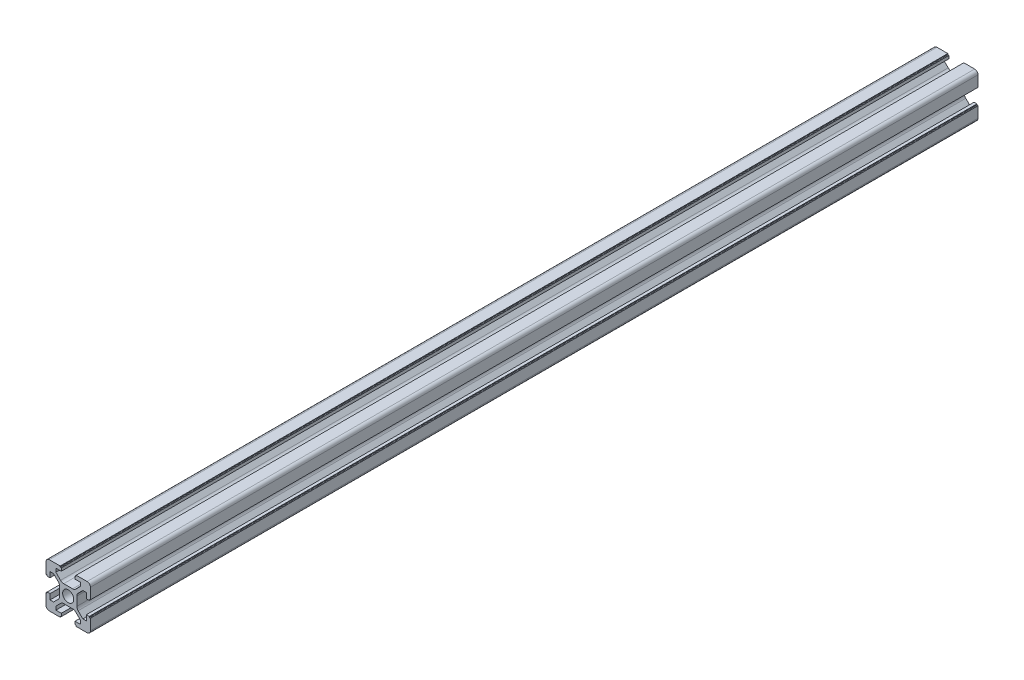
from build123d import *

# Parameters (mm, degrees)
SKETCH1_R      = 2.5
EXTRUDE1_DEPTH = 400


with BuildPart() as part:
    # Sketch1 → Extrude1 (new body)
    with BuildSketch(Plane.XY):
        with BuildLine():
            Line((0, 3.9), (-2.010912703, 3.9))
            ThreePointArc((-2.010912703, 3.9), (-2.776279568, 4.052240935), (-3.425126266, 4.485786438))
            Line((-3.425126266, 4.485786438), (-5.539339828, 6.6))
            Line((-5.539339828, 6.6), (-5.539339828, 8.2))
            Line((-5.539339828, 8.2), (-3.1, 8.2))
            Line((-3.1, 8.2), (-3.1, 9.5))
            Line((-3.1, 9.5), (-3.4, 9.5))
            ThreePointArc((-3.4, 9.5), (-3.541421356, 9.558578644), (-3.6, 9.7))
            Line((-3.6, 9.7), (-3.6, 10))
            Line((-3.6, 10), (-8.5, 10))
            ThreePointArc((-8.5, 10), (-9.560660172, 9.560660172), (-10, 8.5))
            Line((-10, 8.5), (-10, 3.6))
            Line((-10, 3.6), (-9.7, 3.6))
            ThreePointArc((-9.7, 3.6), (-9.558578644, 3.541421356), (-9.5, 3.4))
            Line((-9.5, 3.4), (-9.5, 3.1))
            Line((-9.5, 3.1), (-8.2, 3.1))
            Line((-8.2, 3.1), (-8.2, 5.539339828))
            Line((-8.2, 5.539339828), (-6.6, 5.539339828))
            Line((-6.6, 5.539339828), (-4.485786438, 3.425126266))
            ThreePointArc((-4.485786438, 3.425126266), (-4.052240935, 2.776279568), (-3.9, 2.010912703))
            Line((-3.9, 2.010912703), (-3.9, 0))
            Line((-3.9, 0), (-3.9, -2.010912703))
            ThreePointArc((-3.9, -2.010912703), (-4.052240935, -2.776279568), (-4.485786438, -3.425126266))
            Line((-4.485786438, -3.425126266), (-6.6, -5.539339828))
            Line((-6.6, -5.539339828), (-8.2, -5.539339828))
            Line((-8.2, -5.539339828), (-8.2, -3.1))
            Line((-8.2, -3.1), (-9.5, -3.1))
            Line((-9.5, -3.1), (-9.5, -3.4))
            ThreePointArc((-9.5, -3.4), (-9.558578644, -3.541421356), (-9.7, -3.6))
            Line((-9.7, -3.6), (-10, -3.6))
            Line((-10, -3.6), (-10, -8.5))
            ThreePointArc((-10, -8.5), (-9.560660172, -9.560660172), (-8.5, -10))
            Line((-8.5, -10), (-3.6, -10))
            Line((-3.6, -10), (-3.6, -9.7))
            ThreePointArc((-3.6, -9.7), (-3.541421356, -9.558578644), (-3.4, -9.5))
            Line((-3.4, -9.5), (-3.1, -9.5))
            Line((-3.1, -9.5), (-3.1, -8.2))
            Line((-3.1, -8.2), (-5.539339828, -8.2))
            Line((-5.539339828, -8.2), (-5.539339828, -6.6))
            Line((-5.539339828, -6.6), (-3.425126266, -4.485786438))
            ThreePointArc((-3.425126266, -4.485786438), (-2.776279568, -4.052240935), (-2.010912703, -3.9))
            Line((-2.010912703, -3.9), (0, -3.9))
            Line((0, -3.9), (2.010912703, -3.9))
            ThreePointArc((2.010912703, -3.9), (2.776279568, -4.052240935), (3.425126266, -4.485786438))
            Line((3.425126266, -4.485786438), (5.539339828, -6.6))
            Line((5.539339828, -6.6), (5.539339828, -8.2))
            Line((5.539339828, -8.2), (3.1, -8.2))
            Line((3.1, -8.2), (3.1, -9.5))
            Line((3.1, -9.5), (3.4, -9.5))
            ThreePointArc((3.4, -9.5), (3.541421356, -9.558578644), (3.6, -9.7))
            Line((3.6, -9.7), (3.6, -10))
            Line((3.6, -10), (8.5, -10))
            ThreePointArc((8.5, -10), (9.560660172, -9.560660172), (10, -8.5))
            Line((10, -8.5), (10, -3.6))
            Line((10, -3.6), (9.7, -3.6))
            ThreePointArc((9.7, -3.6), (9.558578644, -3.541421356), (9.5, -3.4))
            Line((9.5, -3.4), (9.5, -3.1))
            Line((9.5, -3.1), (8.2, -3.1))
            Line((8.2, -3.1), (8.2, -5.539339828))
            Line((8.2, -5.539339828), (6.6, -5.539339828))
            Line((6.6, -5.539339828), (4.485786438, -3.425126266))
            ThreePointArc((4.485786438, -3.425126266), (4.052240935, -2.776279568), (3.9, -2.010912703))
            Line((3.9, -2.010912703), (3.9, 0))
            Line((3.9, 0), (3.9, 2.010912703))
            ThreePointArc((3.9, 2.010912703), (4.052240935, 2.776279568), (4.485786438, 3.425126266))
            Line((4.485786438, 3.425126266), (6.6, 5.539339828))
            Line((6.6, 5.539339828), (8.2, 5.539339828))
            Line((8.2, 5.539339828), (8.2, 3.1))
            Line((8.2, 3.1), (9.5, 3.1))
            Line((9.5, 3.1), (9.5, 3.4))
            ThreePointArc((9.5, 3.4), (9.558578644, 3.541421356), (9.7, 3.6))
            Line((9.7, 3.6), (10, 3.6))
            Line((10, 3.6), (10, 8.5))
            ThreePointArc((10, 8.5), (9.560660172, 9.560660172), (8.5, 10))
            Line((8.5, 10), (3.6, 10))
            Line((3.6, 10), (3.6, 9.7))
            ThreePointArc((3.6, 9.7), (3.541421356, 9.558578644), (3.4, 9.5))
            Line((3.4, 9.5), (3.1, 9.5))
            Line((3.1, 9.5), (3.1, 8.2))
            Line((3.1, 8.2), (5.539339828, 8.2))
            Line((5.539339828, 8.2), (5.539339828, 6.6))
            Line((5.539339828, 6.6), (3.425126266, 4.485786438))
            ThreePointArc((3.425126266, 4.485786438), (2.776279568, 4.052240935), (2.010912703, 3.9))
            Line((2.010912703, 3.9), (0, 3.9))
        make_face()
        Circle(SKETCH1_R, mode=Mode.SUBTRACT)
    extrude(amount=EXTRUDE1_DEPTH)


solid = part.part
